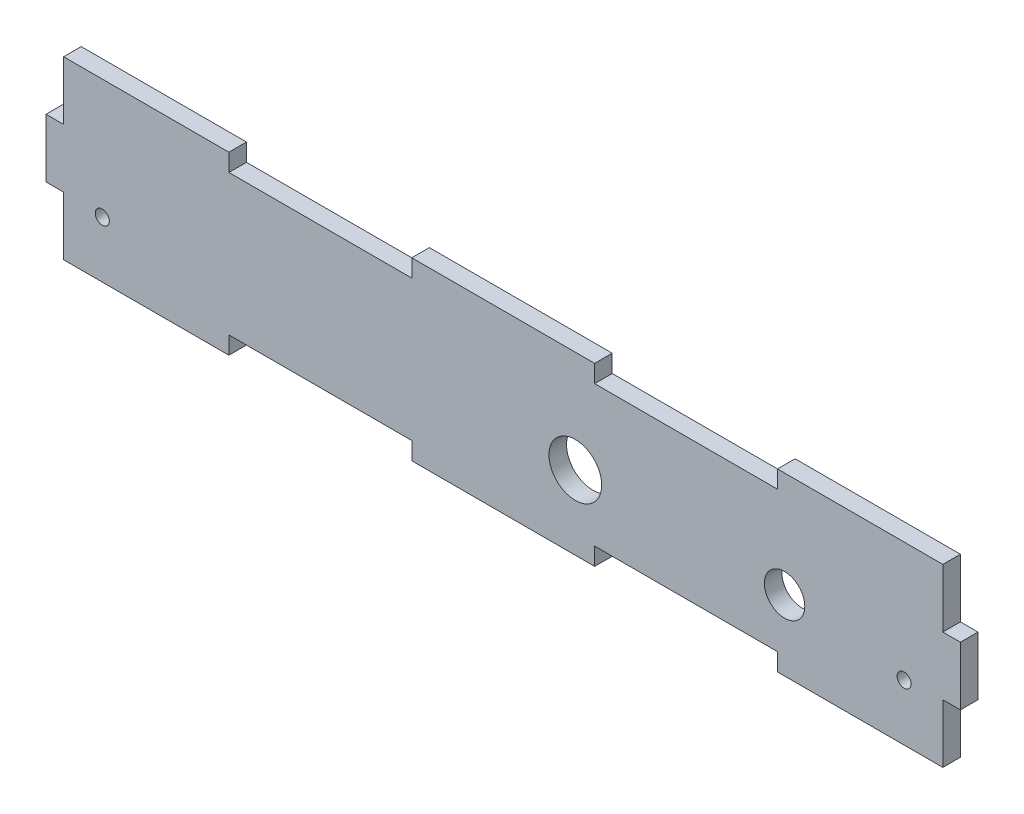
from build123d import *

# Parameters (mm, degrees)
CROQUIS1_R              = 2
SALIENTE_EXTRUIR1_DEPTH = 5
CROQUIS2_R              = 5.75
CROQUIS2_R_2            = 7.5
CORTAR_EXTRUIR1_DEPTH   = 10


with BuildPart() as part:
    # Croquis1 → Saliente-Extruir1 (new body)
    with BuildSketch(Plane.XY):
        Polygon((0, 33.333333333), (5, 33.333333333), (5, 50), (52, 50), (52, 45), (104, 45), (104, 50), (156, 50), (156, 45), (208, 45), (208, 50), (255, 50), (255, 33.333333333), (260, 33.333333333), (260, 16.666666667), (255, 16.666666667), (255, 0), (208, 0), (208, 5), (156, 5), (156, 0), (104, 0), (104, 5), (52, 5), (52, 0), (5, 0), (5, 16.666666667), (0, 16.666666667), align=None)
        with Locations((16, 16)):
            Circle(CROQUIS1_R, mode=Mode.SUBTRACT)
        with Locations(Location((244, 16, 0), (0, 0, 180))):
            Circle(CROQUIS1_R, mode=Mode.SUBTRACT)
    extrude(amount=SALIENTE_EXTRUIR1_DEPTH)

    # Croquis2 → Cortar-Extruir1 (cut)
    with BuildSketch(Plane.XY.offset(5)):
        with Locations((210, 20)):
            Circle(CROQUIS2_R)
        with Locations((150.5, 21)):
            Circle(CROQUIS2_R_2)
    extrude(amount=-CORTAR_EXTRUIR1_DEPTH, mode=Mode.SUBTRACT)


solid = part.part
